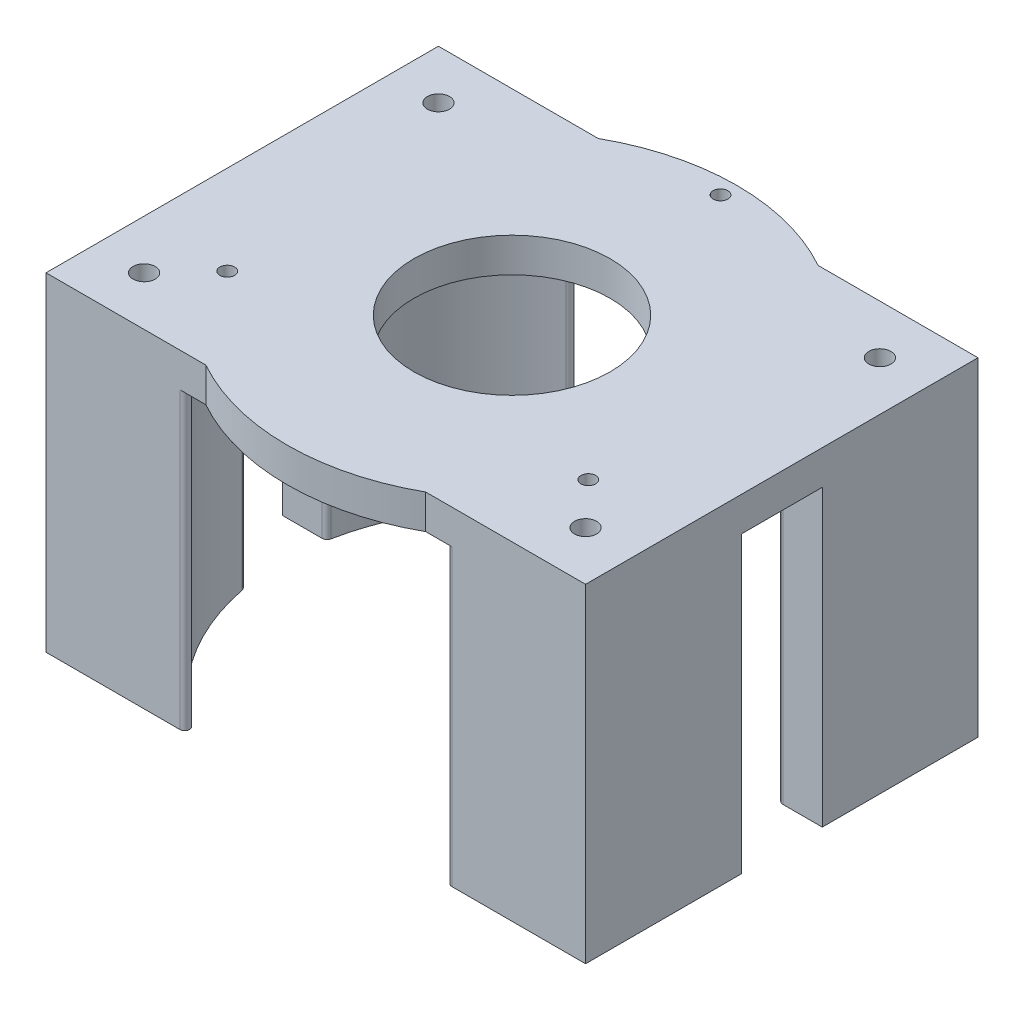
from build123d import *

# Parameters (mm, degrees)
SKETCH1_R             = 2.25
BOSS_EXTRUDE1_DEPTH   = 60
BOSS_EXTRUDE1_2_DEPTH = 60
BOSS_EXTRUDE1_3_DEPTH = 60
BOSS_EXTRUDE1_4_DEPTH = 60
SKETCH5_R             = 1.5
SKETCH5_R_2           = 20
SKETCH5_R_3           = 2.25
BOSS_EXTRUDE3_DEPTH   = 7
FILLET1_R             = 1


with BuildPart() as part:
    # Sketch1 → Boss-Extrude1 (new body)
    with BuildSketch(Plane(origin=(0, 0, 0), x_dir=(1, 0, 0), z_dir=(0, 1, 0))):
        with BuildLine():
            ThreePointArc((20.608966812, 70), (6.336439637, 56.458488242), (-1.117716003, 38.250986042))
            Line((-1.117716003, 38.250986042), (-10, 38.250986042))
            Line((-10, 38.250986042), (-10, 70))
            Line((-10, 70), (20.608966812, 70))
        make_face()
        with Locations(Location((0, 60, 0), (0, 0, 270))):
            Circle(SKETCH1_R, mode=Mode.SUBTRACT)
    extrude(amount=BOSS_EXTRUDE1_DEPTH)



with BuildPart() as body_2:
    # Sketch1 → Boss-Extrude1 2 (new body)
    with BuildSketch(Plane(origin=(0, 0, 0), x_dir=(1, 0, 0), z_dir=(0, 1, 0))):
        with BuildLine():
            ThreePointArc((-1.117716003, 21.749013958), (6.336439637, 3.541511758), (20.608966812, -10))
            Line((20.608966812, -10), (-10, -10))
            Line((-10, -10), (-10, 21.749013958))
            Line((-10, 21.749013958), (-1.117716003, 21.749013958))
        make_face()
        with Locations(Location((0, 0, 0), (0, 0, 270))):
            Circle(SKETCH1_R, mode=Mode.SUBTRACT)
    extrude(amount=BOSS_EXTRUDE1_2_DEPTH)


with BuildPart() as body_3:
    # Sketch1 → Boss-Extrude1 3 (new body)
    with BuildSketch(Plane(origin=(0, 0, 0), x_dir=(1, 0, 0), z_dir=(0, 1, 0))):
        with BuildLine():
            ThreePointArc((91.117716003, 38.250986042), (83.663560363, 56.458488242), (69.391033188, 70))
            Line((69.391033188, 70), (100, 70))
            Line((100, 70), (100, 38.250986042))
            Line((100, 38.250986042), (91.117716003, 38.250986042))
        make_face()
        with Locations(Location((90, 60, 0), (0, 0, 270))):
            Circle(SKETCH1_R, mode=Mode.SUBTRACT)
    extrude(amount=BOSS_EXTRUDE1_3_DEPTH)


with BuildPart() as body_4:
    # Sketch1 → Boss-Extrude1 4 (new body)
    with BuildSketch(Plane(origin=(0, 0, 0), x_dir=(1, 0, 0), z_dir=(0, 1, 0))):
        with BuildLine():
            ThreePointArc((69.391033188, -10), (83.663560363, 3.541511758), (91.117716003, 21.749013958))
            Line((91.117716003, 21.749013958), (100, 21.749013958))
            Line((100, 21.749013958), (100, -10))
            Line((100, -10), (69.391033188, -10))
        make_face()
        with Locations(Location((90, 0, 0), (0, 0, 270))):
            Circle(SKETCH1_R, mode=Mode.SUBTRACT)
    extrude(amount=BOSS_EXTRUDE1_4_DEPTH)


with BuildPart() as part_1:
    add(part.part)

    add(body_2.part)  # Boss-Extrude3 merges body 2

    add(body_3.part)  # Boss-Extrude3 merges body 3

    add(body_4.part)  # Boss-Extrude3 merges body 4
    # Sketch5 → Boss-Extrude3 (add)
    with BuildSketch(Plane(origin=(0, 60, 0), x_dir=(1, 0, 0), z_dir=(0, 1, 0))):
        with BuildLine():
            Line((-10, 70), (22.589678717, 70))
            ThreePointArc((22.589678717, 70), (45, 75.85), (67.410321283, 70))
            Line((67.410321283, 70), (100, 70))
            Line((100, 70), (100, -10))
            Line((100, -10), (67.410321283, -10))
            ThreePointArc((67.410321283, -10), (45, -15.85), (22.589678717, -10))
            Line((22.589678717, -10), (-10, -10))
            Line((-10, -10), (-10, 70))
        make_face()
        with Locations(Location((81.806079661, 8.75, 0), (0, 0, 270))):
            Circle(SKETCH5_R, mode=Mode.SUBTRACT)
        with Locations(Location((45, 72.5, 0), (0, 0, 270))):
            Circle(SKETCH5_R, mode=Mode.SUBTRACT)
        with Locations(Location((8.193920339, 8.75, 0), (0, 0, 270))):
            Circle(SKETCH5_R, mode=Mode.SUBTRACT)
        with Locations(Location((45, 30, 0), (0, 0, 270))):
            Circle(SKETCH5_R_2, mode=Mode.SUBTRACT)
        with Locations(Location((90, 60, 0), (0, 0, 270))):
            Circle(SKETCH5_R_3, mode=Mode.SUBTRACT)
        with Locations(Location((90, 0, 0), (0, 0, 270))):
            Circle(SKETCH5_R_3, mode=Mode.SUBTRACT)
        with Locations(Location((0, 0, 0), (0, 0, 270))):
            Circle(SKETCH5_R_3, mode=Mode.SUBTRACT)
        with Locations(Location((0, 60, 0), (0, 0, 270))):
            Circle(SKETCH5_R_3, mode=Mode.SUBTRACT)
    extrude(amount=BOSS_EXTRUDE3_DEPTH)

    # Fillet1
    fillet1_edges = [part_1.edges().sort_by_distance(p)[0] for p in [
        (-1.117716003, 30, -38.250986042),
        (20.608966812, 30, -70),
        (20.608966812, 30, 10),
        (-1.117716003, 30, -21.749013958),
        (69.391033188, 30, -70),
        (91.117716003, 30, -38.250986042),
        (91.117716003, 30, -21.749013958),
        (69.391033188, 30, 10),
    ]]
    fillet(fillet1_edges, radius=FILLET1_R)


solid = part_1.part
